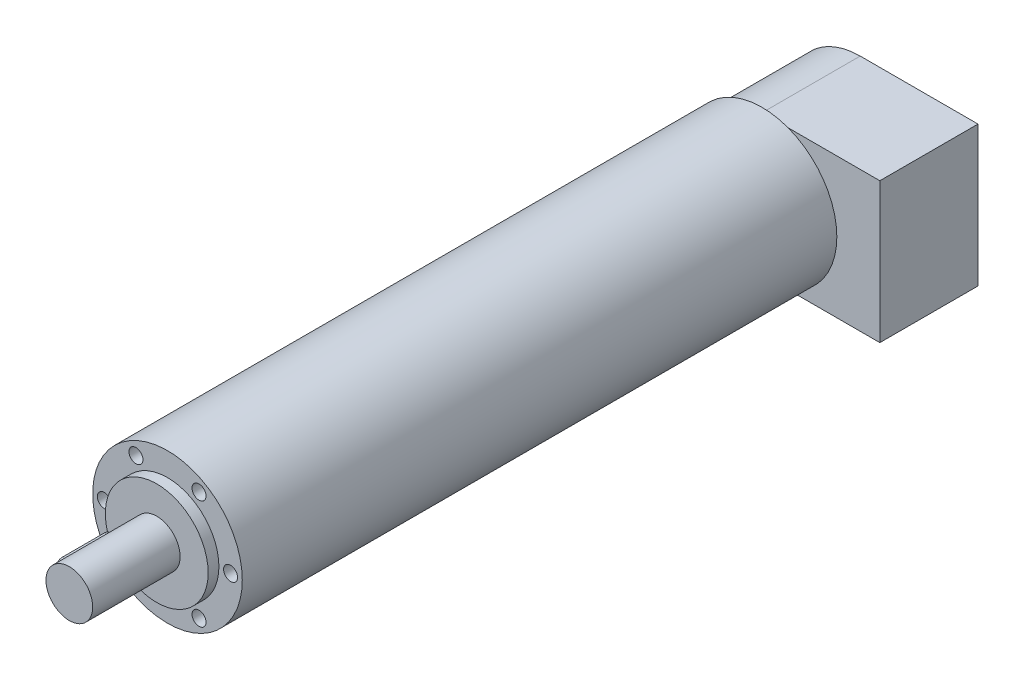
from build123d import *

# Parameters (mm, degrees)
SKETCH1_R           = 15
BOSS_EXTRUDE1_DEPTH = 21
SKETCH2_W           = 21
SKETCH2_H           = 30
BOSS_EXTRUDE2_DEPTH = 25.2
SKETCH3_R           = 16
BOSS_EXTRUDE3_DEPTH = 127.2
SKETCH4_R           = 11
BOSS_EXTRUDE4_DEPTH = 2.3
SKETCH6_R           = 5
BOSS_EXTRUDE6_DEPTH = 18.7
BOSS_EXTRUDE7_DEPTH = 6
SKETCH7_R           = 1.5
CUT_EXTRUDE1_DEPTH  = 10
CIRPATTERN1_COUNT   = 6


with BuildPart() as part:
    # Sketch1 → Boss-Extrude1 (new body)
    with BuildSketch(Plane.XY):
        with Locations(Location((0, 0, 0), (0, 0, 180))):
            Circle(SKETCH1_R)
    extrude(amount=BOSS_EXTRUDE1_DEPTH)

    # Sketch2 → Boss-Extrude2 (add)
    with BuildSketch(Plane(origin=(0, 0, 0), x_dir=(0, 0, -1), z_dir=(1, 0, 0))):
        with Locations((-10.5, 0)):
            Rectangle(SKETCH2_W, SKETCH2_H)
    extrude(amount=BOSS_EXTRUDE2_DEPTH)

    # Sketch3 → Boss-Extrude3 (add)
    with BuildSketch(Plane.XY.offset(21)):
        with Locations(Location((0, 0, 0), (0, 0, 290.364134806))):
            Circle(SKETCH3_R)
    extrude(amount=BOSS_EXTRUDE3_DEPTH)

    # Sketch4 → Boss-Extrude4 (add)
    with BuildSketch(Plane.XY.offset(148.2)):
        Circle(SKETCH4_R)
    extrude(amount=BOSS_EXTRUDE4_DEPTH)

    # Sketch6 → Boss-Extrude6 (add)
    with BuildSketch(Plane.XY.offset(150.5)):
        Circle(SKETCH6_R)
    extrude(amount=BOSS_EXTRUDE6_DEPTH)

    # Sketch5 → Boss-Extrude7 (add)
    with BuildSketch(Plane(origin=(0, 0, 0), x_dir=(0, 0, -1), z_dir=(1, 0, 0))):
        with BuildLine():
            Line((-155.7, 1.5), (-164.7, 1.5))
            ThreePointArc((-164.7, 1.5), (-166.2, 0), (-164.7, -1.5))
            Line((-164.7, -1.5), (-155.7, -1.5))
            ThreePointArc((-155.7, -1.5), (-154.2, 0), (-155.7, 1.5))
        make_face()
    extrude(amount=-BOSS_EXTRUDE7_DEPTH)

    # Sketch7 → Cut-Extrude1 (cut)
    with BuildSketch(Plane.XY.offset(148.2)):
        with Locations((13.5, 0)):
            Circle(SKETCH7_R)
    cut_extrude1 = extrude(amount=-CUT_EXTRUDE1_DEPTH, mode=Mode.SUBTRACT)

    # CirPattern1: Cut-Extrude1 ×6 about axis
    cirpattern1_axis = Axis((0, 0, 0), (0, 0, 1))
    for i in range(1, CIRPATTERN1_COUNT):
        add(cut_extrude1.rotate(cirpattern1_axis, i * 360 / CIRPATTERN1_COUNT), mode=Mode.SUBTRACT)


solid = part.part
